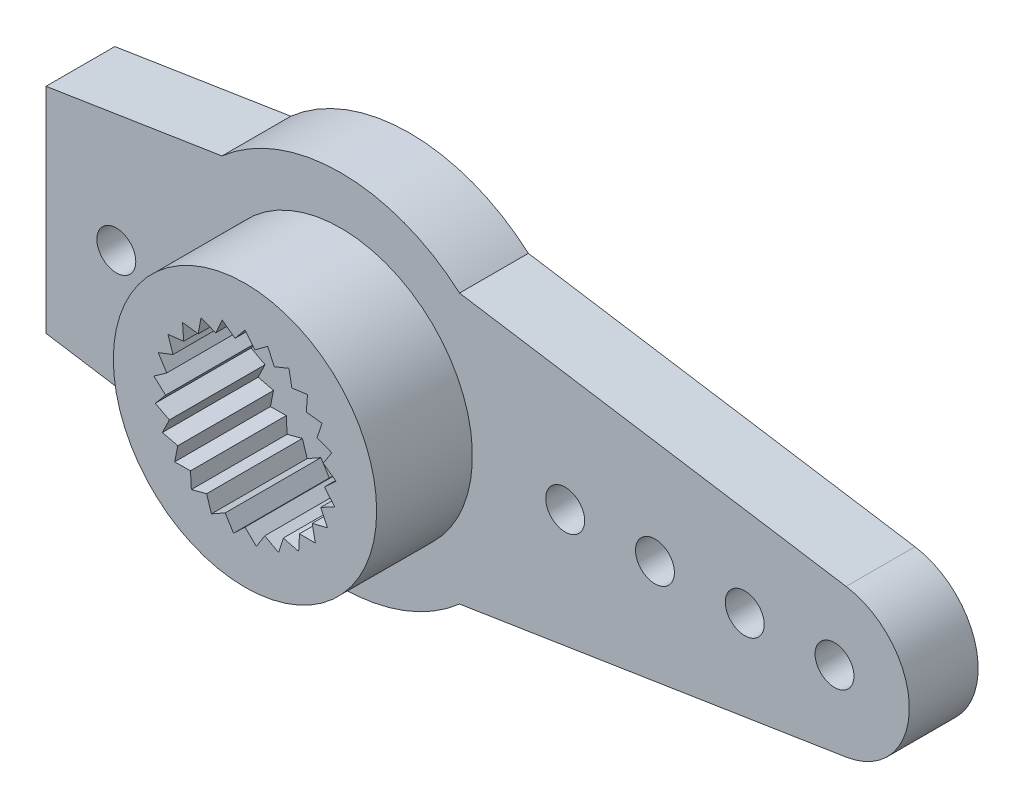
from build123d import *

# Parameters (mm, degrees)
SKETCH_1_R          = 0.65
SKETCH_1_R_2        = 1.5
EXTRUDE_1_DEPTH     = 2.3
SKETCH_2_R          = 4.4
EXTRUDE_2_DEPTH     = 3.2
SKETCH_3_R          = 4.4
SKETCH_3_R_2        = 3.4
SKETCH_3_R_3        = 2.75
SKETCH_3_R_4        = 1.5
CUT_EXTRUDE_1_DEPTH = 1
SKETCH1_W           = 12.345584807
SKETCH1_H           = 16.477608666
CUT_EXTRUDE2_DEPTH  = 10


with BuildPart() as part:
    # Эскиз1 → Бобышка-Вытянуть1 (new body)
    with BuildSketch(Plane.XY):
        with BuildLine():
            Line((-3.968626967, 4.5), (-16.888114198, 2.469689731))
            ThreePointArc((-16.888114198, 2.469689731), (-19, 0), (-16.888114198, -2.469689731))
            Line((-16.888114198, -2.469689731), (-3.968626967, -4.5))
            ThreePointArc((-3.968626967, -4.5), (0, -6), (3.968626967, -4.5))
            Line((3.968626967, -4.5), (16.888114198, -2.469689731))
            ThreePointArc((16.888114198, -2.469689731), (19, 0), (16.888114198, 2.469689731))
            Line((16.888114198, 2.469689731), (3.968626967, 4.5))
            ThreePointArc((3.968626967, 4.5), (0, 6), (-3.968626967, 4.5))
        make_face()
        with Locations((-16.5, 0)):
            Circle(SKETCH_1_R, mode=Mode.SUBTRACT)
        with Locations((-13.5, 0)):
            Circle(SKETCH_1_R, mode=Mode.SUBTRACT)
        with Locations((-10.5, 0)):
            Circle(SKETCH_1_R, mode=Mode.SUBTRACT)
        with Locations((-7.5, 0)):
            Circle(SKETCH_1_R, mode=Mode.SUBTRACT)
        with Locations(Location((16.5, 0, 0), (0, 0, 180))):
            Circle(SKETCH_1_R, mode=Mode.SUBTRACT)
        with Locations(Location((7.5, 0, 0), (0, 0, 180))):
            Circle(SKETCH_1_R, mode=Mode.SUBTRACT)
        with Locations(Location((10.5, 0, 0), (0, 0, 180))):
            Circle(SKETCH_1_R, mode=Mode.SUBTRACT)
        with Locations(Location((13.5, 0, 0), (0, 0, 180))):
            Circle(SKETCH_1_R, mode=Mode.SUBTRACT)
        Circle(SKETCH_1_R_2, mode=Mode.SUBTRACT)
    extrude(amount=EXTRUDE_1_DEPTH)

    # Эскиз2 → Бобышка-Вытянуть2 (add)
    with BuildSketch(Plane.XY.offset(2.3)):
        with Locations(Location((0, 0, 0), (0, 0, 180))):
            Circle(SKETCH_2_R)
        Polygon((0.333439775, 2.639447604), (0, 3.05), (-0.333439775, 2.639447604), (-0.758504156, 2.954178641), (-0.979368078, 2.473601404), (-1.469348706, 2.672735374), (-1.563759083, 2.15232973), (-2.087868673, 2.223354314), (-2.049893354, 1.695819264), (-2.575200173, 1.634271725), (-2.407225286, 1.132754236), (-2.900722375, 0.942501833), (-2.6133024, 0.498514094), (-3.043981522, 0.191511085), (-2.655176114, -0.167049522), (-2.995976115, -0.571513009), (-2.530215347, -0.822116802), (-2.75972251, -1.298626839), (-2.246271844, -1.42552746), (-2.35006539, -1.944143169), (-1.821186821, -1.939366985), (-1.792745019, -2.467501833), (-1.281669931, -2.33134895), (-1.122779886, -2.835818282), (-0.661621006, -2.576843686), (-0.382266362, -3.025949839), (0, -2.660425857), (0.382266362, -3.025949839), (0.661621006, -2.576843686), (1.122779886, -2.835818282), (1.281669931, -2.33134895), (1.792745019, -2.467501833), (1.821186821, -1.939366985), (2.35006539, -1.944143169), (2.246271844, -1.42552746), (2.75972251, -1.298626839), (2.530215347, -0.822116802), (2.995976115, -0.571513009), (2.655176114, -0.167049522), (3.043981522, 0.191511085), (2.6133024, 0.498514094), (2.900722375, 0.942501833), (2.407225286, 1.132754236), (2.575200173, 1.634271725), (2.049893354, 1.695819264), (2.087868673, 2.223354314), (1.563759083, 2.15232973), (1.469348706, 2.672735374), (0.979368078, 2.473601404), (0.758504156, 2.954178641), align=None, mode=Mode.SUBTRACT)
    extrude(amount=EXTRUDE_2_DEPTH)

    # Эскиз3 → Вырез-Вытянуть1 (cut)
    # profile 1 of 2: a face of its own
    with BuildSketch(Plane(origin=(0, 0, 0), x_dir=(-1, 0, 0), z_dir=(0, 0, -1))):
        Circle(SKETCH_3_R)
        Circle(SKETCH_3_R_2, mode=Mode.SUBTRACT)
    # profile 2 of 2: a face of its own
    with BuildSketch(Plane(origin=(0, 0, 0), x_dir=(-1, 0, 0), z_dir=(0, 0, -1))):
        Circle(SKETCH_3_R_3)
        Circle(SKETCH_3_R_4, mode=Mode.SUBTRACT)
    extrude(amount=-CUT_EXTRUDE_1_DEPTH, mode=Mode.SUBTRACT)

    # Sketch1 → Cut-Extrude2 (cut)
    with BuildSketch(Plane(origin=(0, 0, 0), x_dir=(-1, 0, 0), z_dir=(0, 0, -1))):
        with Locations((16.022792404, -0.737803373)):
            Rectangle(SKETCH1_W, SKETCH1_H)
    extrude(amount=-CUT_EXTRUDE2_DEPTH, mode=Mode.SUBTRACT)


solid = part.part
